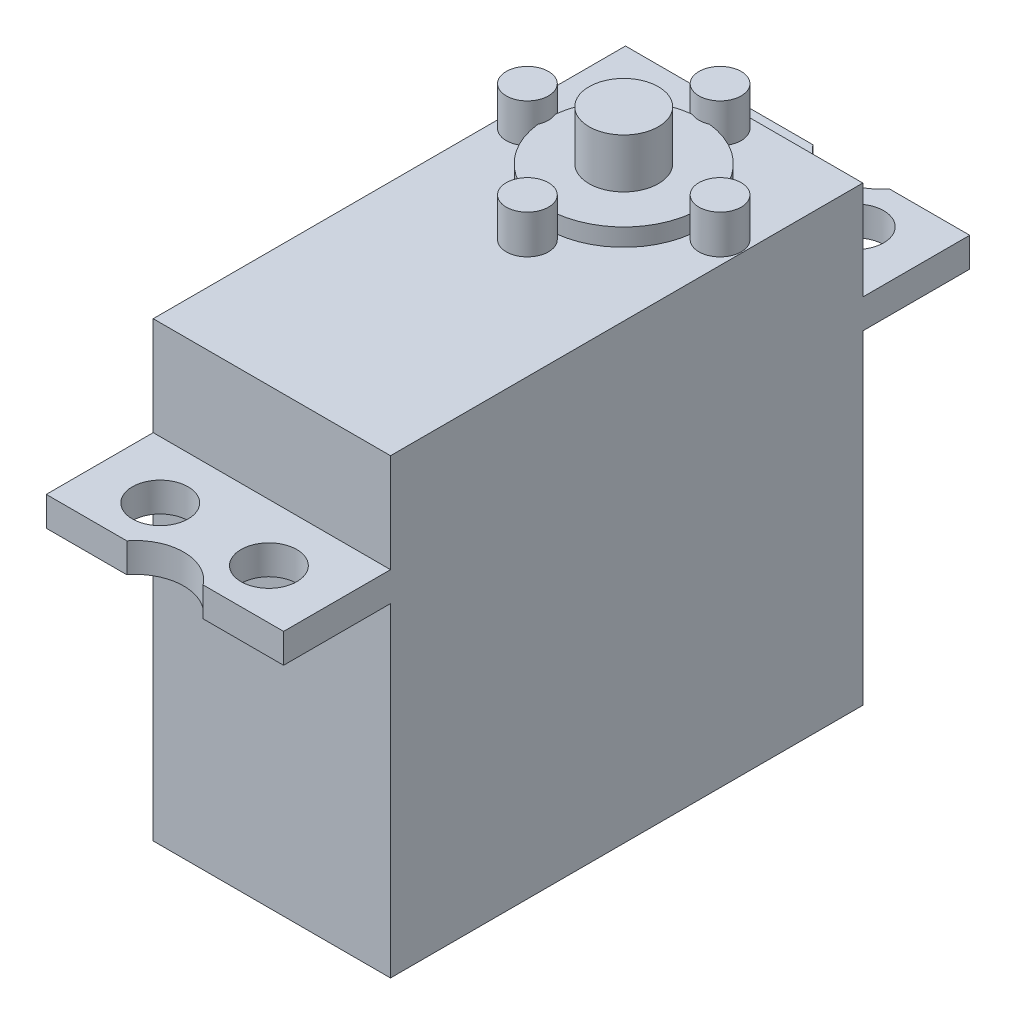
from build123d import *

# Parameters (mm, degrees)
BOSS_EXTRU_1_DEPTH      = 20.2
ESQUISSE2_R             = 4.10078125
ESQUISSE2_R_2           = 2.375
ENL_V_MAT_EXTRU_1_DEPTH = 62.192646617
ESQUISSE3_R             = 2.95
BOSS_EXTRU_2_DEPTH      = 5.7
ESQUISSE4_R             = 1.8
BOSS_EXTRU_3_DEPTH      = 3.3
ESQUISSE5_R             = 6.6
BOSS_EXTRU_4_DEPTH      = 1.5
ESQUISSE6_W             = 7.5
ESQUISSE6_H             = 5
BOSS_EXTRU_5_DEPTH      = 1
BOSS_EXTRU_6_DEPTH      = 4


with BuildPart() as part:
    # Esquisse1 → Boss.-Extru.1 (new body)
    with BuildSketch(Plane(origin=(0, 0, 0), x_dir=(0, 0, -1), z_dir=(1, 0, 0))):
        Polygon((0, 0), (40.2, 0), (40.2, 27.6), (49.3, 27.6), (49.3, 30.1), (40.2, 30.1), (40.2, 38.5), (0, 38.5), (0, 30.1), (-9.1, 30.1), (-9.1, 27.6), (0, 27.6), align=None)
    extrude(amount=BOSS_EXTRU_1_DEPTH)

    # Esquisse2 → Enlèv. mat.-Extru.1 (cut, through all)
    with BuildSketch(Plane(origin=(0, 30.1, 0), x_dir=(1, 0, 0), z_dir=(0, 1, 0))):
        with Locations((10.1, 51.80078125)):
            Circle(ESQUISSE2_R)
        with Locations(Location((5.475, 45.075, 0), (0, 0, 270))):
            Circle(ESQUISSE2_R_2)
        with Locations(Location((14.725, 45.075, 0), (0, 0, 270))):
            Circle(ESQUISSE2_R_2)
        with Locations(Location((14.725, -4.875, 0), (0, 0, 270))):
            Circle(ESQUISSE2_R_2)
        with Locations(Location((5.475, -4.875, 0), (0, 0, 270))):
            Circle(ESQUISSE2_R_2)
        with Locations((10.1, -11.60078125)):
            Circle(ESQUISSE2_R)
    extrude(amount=-ENL_V_MAT_EXTRU_1_DEPTH, mode=Mode.SUBTRACT)

    # Esquisse3 → Boss.-Extru.2 (add)
    with BuildSketch(Plane(origin=(0, 38.5, 0), x_dir=(1, 0, 0), z_dir=(0, 1, 0))):
        with Locations(Location((10.1, 29.95, 0), (0, 0, 90))):
            Circle(ESQUISSE3_R)
    extrude(amount=BOSS_EXTRU_2_DEPTH)

    # Esquisse4 → Boss.-Extru.3 (add)
    with BuildSketch(Plane(origin=(0, 38.5, 0), x_dir=(1, 0, 0), z_dir=(0, 1, 0))):
        with Locations(Location((1.9, 29.95, 0), (0, 0, 90))):
            Circle(ESQUISSE4_R)
        with Locations(Location((10.1, 38.15, 0), (0, 0, 90))):
            Circle(ESQUISSE4_R)
        with Locations(Location((18.3, 29.95, 0), (0, 0, 90))):
            Circle(ESQUISSE4_R)
        with Locations(Location((10.1, 21.75, 0), (0, 0, 90))):
            Circle(ESQUISSE4_R)
    extrude(amount=BOSS_EXTRU_3_DEPTH)

    # Esquisse5 → Boss.-Extru.4 (add)
    with BuildSketch(Plane(origin=(0, 38.5, 0), x_dir=(1, 0, 0), z_dir=(0, 1, 0))):
        with Locations((10.1, 29.95)):
            Circle(ESQUISSE5_R)
    extrude(amount=BOSS_EXTRU_4_DEPTH)

    # Esquisse6 → Boss.-Extru.5 (add)
    with BuildSketch(Plane(origin=(0, 0, -40.2), x_dir=(-1, 0, 0), z_dir=(0, 0, -1))):
        with Locations((-10.1, 5)):
            Rectangle(ESQUISSE6_W, ESQUISSE6_H)
    extrude(amount=BOSS_EXTRU_5_DEPTH)

    # Esquisse7 → Boss.-Extru.6 (add)
    with BuildSketch(Plane(origin=(0, 0, -41.2), x_dir=(-1, 0, 0), z_dir=(0, 0, -1))):
        with BuildLine():
            Line((-11.5, 6.5), (-8.7, 6.5))
            ThreePointArc((-8.7, 6.5), (-7.2, 5), (-8.7, 3.5))
            Line((-8.7, 3.5), (-11.5, 3.5))
            ThreePointArc((-11.5, 3.5), (-13, 5), (-11.5, 6.5))
        make_face()
    extrude(amount=BOSS_EXTRU_6_DEPTH)


solid = part.part
